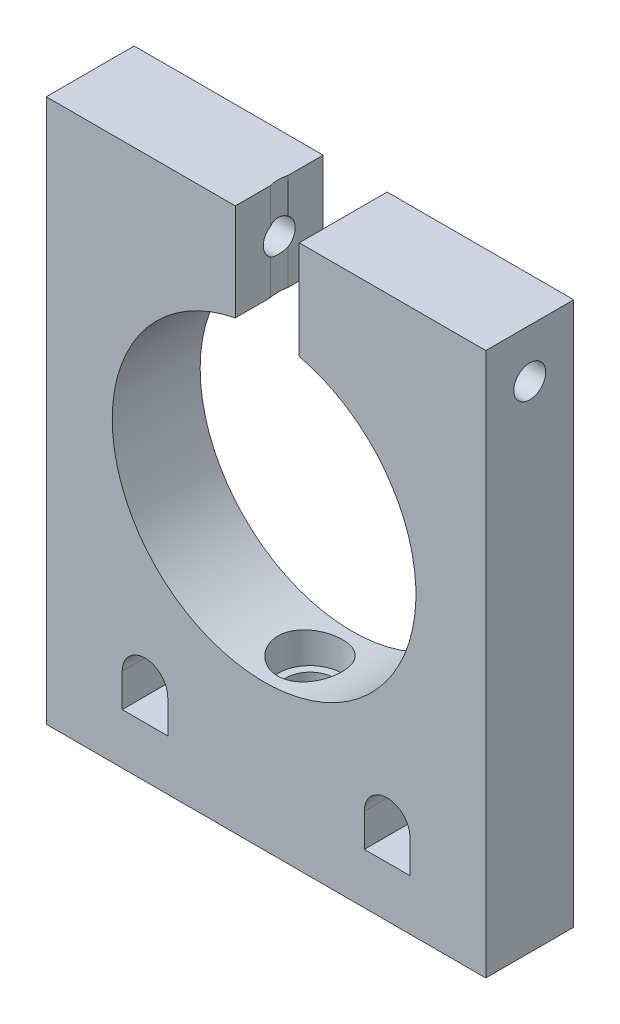
from build123d import *

# Parameters (mm, degrees)
SKETCH1_W           = 55
SKETCH1_H           = 18
BOSS_EXTRUDE1_DEPTH = 15
SKETCH2_W           = 55
SKETCH2_H           = 15
BOSS_EXTRUDE2_DEPTH = 50
SKETCH14_R          = 19
CUT_EXTRUDE14_DEPTH = 21
SKETCH6_W           = 8
SKETCH6_H           = 27.884489578
CUT_EXTRUDE3_DEPTH  = 50
SKETCH9_R           = 2
CUT_EXTRUDE5_DEPTH  = 55
CUT_EXTRUDE6_DEPTH  = 55
SKETCH16_W          = 55
SKETCH16_H          = 4
CUT_EXTRUDE16_DEPTH = 73
SKETCH17_R          = 3
CUT_EXTRUDE17_DEPTH = 89
SKETCH18_R          = 4
CUT_EXTRUDE18_DEPTH = 89


with BuildPart() as part:
    # Sketch1 → Boss-Extrude1 (new body)
    with BuildSketch(Plane.XY):
        with Locations((-27.5, 32.973684211)):
            Rectangle(SKETCH1_W, SKETCH1_H)
    extrude(amount=BOSS_EXTRUDE1_DEPTH)

    # Sketch2 → Boss-Extrude2 (add)
    with BuildSketch(Plane(origin=(0, 41.973684211, 0), x_dir=(1, 0, 0), z_dir=(0, 1, 0))):
        with Locations((-27.5, -7.5)):
            Rectangle(SKETCH2_W, SKETCH2_H)
    extrude(amount=BOSS_EXTRUDE2_DEPTH)

    # Sketch14 → Cut-Extrude14 (cut)
    with BuildSketch(Plane.XY.offset(15)):
        with Locations((-27.746201243, 61.173684211)):
            Circle(SKETCH14_R)
    extrude(amount=-CUT_EXTRUDE14_DEPTH, mode=Mode.SUBTRACT)

    # Sketch6 → Cut-Extrude3 (cut)
    with BuildSketch(Plane.XY.offset(15)):
        with Locations((-27.350353451, 79.894224222)):
            Rectangle(SKETCH6_W, SKETCH6_H)
    extrude(amount=-CUT_EXTRUDE3_DEPTH, mode=Mode.SUBTRACT)

    # Sketch9 → Cut-Extrude5 (cut)
    with BuildSketch(Plane.ZY.offset(55)):
        with Locations(Location((5.5, 85.888652512, 0), (0, 0, 270))):
            Circle(SKETCH9_R)
    extrude(amount=-CUT_EXTRUDE5_DEPTH, mode=Mode.SUBTRACT)

    # Sketch10 → Cut-Extrude6 (cut)
    with BuildSketch(Plane.XY.offset(15)):
        with BuildLine():
            Line((-9.5, 30.311825803), (-9.5, 34.473684211))
            ThreePointArc((-9.5, 34.473684211), (-12.35, 37.323684211), (-15.2, 34.473684211))
            Line((-15.2, 34.473684211), (-15.2, 30.311825803))
            Line((-15.2, 30.311825803), (-9.5, 30.311825803))
        make_face()
        with BuildLine():
            Line((-45.5, 30.311825803), (-39.8, 30.311825803))
            Line((-39.8, 30.311825803), (-39.8, 34.473684211))
            ThreePointArc((-39.8, 34.473684211), (-42.65, 37.323684211), (-45.5, 34.473684211))
            Line((-45.5, 34.473684211), (-45.5, 30.311825803))
        make_face()
    extrude(amount=-CUT_EXTRUDE6_DEPTH, mode=Mode.SUBTRACT)

    # Sketch16 → Cut-Extrude16 (cut)
    with BuildSketch(Plane(origin=(0, 23.973684211, 0), x_dir=(-1, 0, 0), z_dir=(0, -1, 0))):
        with Locations((27.5, -13)):
            Rectangle(SKETCH16_W, SKETCH16_H)
    extrude(amount=-CUT_EXTRUDE16_DEPTH, mode=Mode.SUBTRACT)

    # Sketch17 → Cut-Extrude17 (cut)
    with BuildSketch(Plane(origin=(0, 23.973684211, 0), x_dir=(-1, 0, 0), z_dir=(0, -1, 0))):
        with Locations(Location((27.5, -5.5, 0), (0, 0, 90))):
            Circle(SKETCH17_R)
    extrude(amount=-CUT_EXTRUDE17_DEPTH, mode=Mode.SUBTRACT)

    # Sketch18 → Cut-Extrude18 (cut)
    with BuildSketch(Plane(origin=(0, 38.5, 0), x_dir=(1, 0, 0), z_dir=(0, 1, 0))):
        with Locations(Location((-27.5, -5.5, 0), (0, 0, 90))):
            Circle(SKETCH18_R)
    extrude(amount=CUT_EXTRUDE18_DEPTH, mode=Mode.SUBTRACT)


solid = part.part
